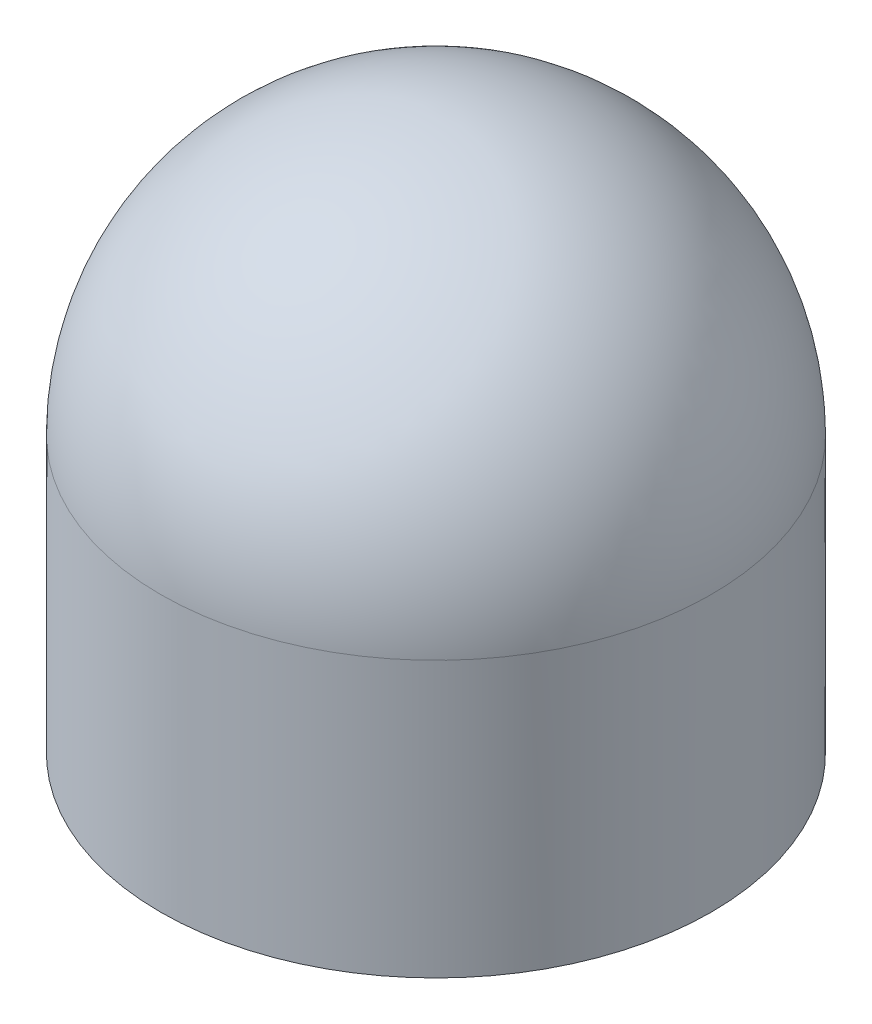
from build123d import *

# Parameters (mm, degrees)
REVOLVE1_ANGLE      = 180
SKETCH2_R           = 25.435125984
BOSS_EXTRUDE1_DEPTH = 25.4


with BuildPart() as part:
    # Sketch1 → Revolve1 (revolve)
    with BuildSketch(Plane(origin=(0, 0, 0), x_dir=(1, 0, 0), z_dir=(0, 1, 0))):
        with BuildLine():
            Line((0, 25.435125984), (0, -25.435125984))
            ThreePointArc((0, -25.435125984), (25.435125984, 0), (0, 25.435125984))
        make_face()
    revolve(axis=Axis((0, 0, -25.435125984), (0, 0, 1)), revolution_arc=REVOLVE1_ANGLE)

    # Sketch2 → Boss-Extrude1 (add)
    with BuildSketch(Plane(origin=(0, 0, 0), x_dir=(-1, 0, 0), z_dir=(0, -1, 0))):
        with Locations(Location((0, 0, 0), (0, 0, 270))):
            Circle(SKETCH2_R)
    extrude(amount=BOSS_EXTRUDE1_DEPTH)


solid = part.part
